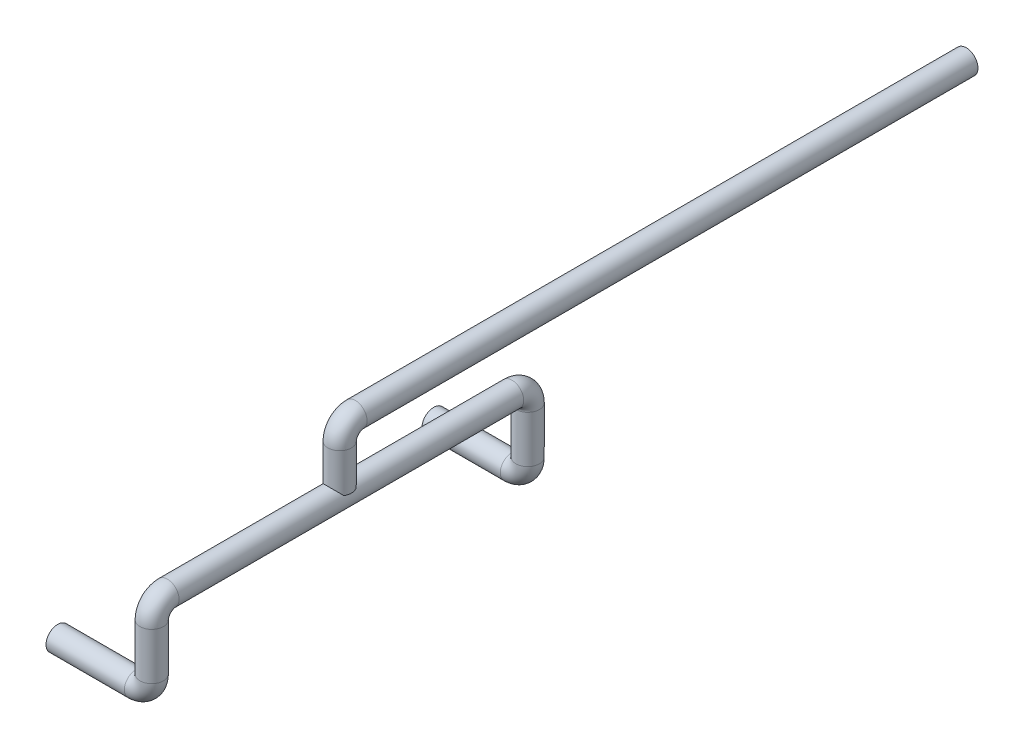
from build123d import *

# Parameters (mm, degrees)
SWEEP1_PROFILE_R     = 7.5
SWEEP2_PROFILE_R     = 7.5
CUT_SWEEP1_PROFILE_R = 6.25
CUT_SWEEP2_PROFILE_R = 6.25


with BuildPart() as part:
    # Sweep1: sweep along a curve in space
    with BuildLine() as sweep1_path:
        Line((-10, -50, 120), (-60, -50, 120))
        ThreePointArc((-10, -50, 120), (-2.928932188, -47.071067812, 120), (0, -40, 120))
        Line((0, -10, 120), (0, -40, 120))
        ThreePointArc((0, -10, 120), (0, -2.928932188, 117.071067812), (0, 0, 110))
        Line((0, 0, 0), (0, 0, 110))
        Line((0, 0, 0), (0, 0, -110))
        ThreePointArc((0, -10, -120), (0, -2.928932188, -117.071067812), (0, 0, -110))
        Line((0, -10, -120), (0, -40, -120))
        ThreePointArc((0, -40, -120), (-2.928932188, -47.071067812, -120), (-10, -50, -120))
        Line((-10, -50, -120), (-60, -50, -120))
    # Sweep1 profile (on start of the path) → Sweep1 (sweep)
    with BuildSketch(Plane(origin=(-60, -50, -120), x_dir=(0, 0, 1), z_dir=(1, 0, 0))):
        Circle(SWEEP1_PROFILE_R)
    sweep(path=sweep1_path.line)

    # Sweep2: sweep along a path in Sketch30
    with BuildLine(Plane(origin=(0, 0, 0), x_dir=(0, 0, -1), z_dir=(1, 0, 0))) as sweep2_path:
        Line((0, 3.788993713), (0, 28.788993713))
        ThreePointArc((0, 28.788993713), (2.928932188, 35.860061525), (10, 38.788993713))
        Line((10, 38.788993713), (400, 38.788993713))
    # Sweep2 profile (on start of the path) → Sweep2 (sweep)
    with BuildSketch(Plane.ZX.offset(3.788993713)):
        Circle(SWEEP2_PROFILE_R)
    sweep(path=sweep2_path.line)

    # Cut-Sweep1: sweep along a curve in space
    with BuildLine() as cut_sweep1_path:
        Line((-10, -50, 120), (-60, -50, 120))
        ThreePointArc((-10, -50, 120), (-2.928932188, -47.071067812, 120), (0, -40, 120))
        Line((0, -10, 120), (0, -40, 120))
        ThreePointArc((0, -10, 120), (0, -2.928932188, 117.071067812), (0, 0, 110))
        Line((0, 0, 0), (0, 0, 110))
        Line((0, 0, 0), (0, 0, -110))
        ThreePointArc((0, -10, -120), (0, -2.928932188, -117.071067812), (0, 0, -110))
        Line((0, -10, -120), (0, -40, -120))
        ThreePointArc((0, -40, -120), (-2.928932188, -47.071067812, -120), (-10, -50, -120))
        Line((-10, -50, -120), (-60, -50, -120))
    # Cut-Sweep1 profile (on start of the path) → Cut-Sweep1 (sweep, cut)
    with BuildSketch(Plane(origin=(-60, -50, -120), x_dir=(0, 0, 1), z_dir=(1, 0, 0))):
        Circle(CUT_SWEEP1_PROFILE_R)
    sweep(path=cut_sweep1_path.line, mode=Mode.SUBTRACT)

    # Cut-Sweep2: sweep along a path in Sketch30<2>
    with BuildLine(Plane(origin=(0, 0, 0), x_dir=(0, 0, -1), z_dir=(1, 0, 0))) as cut_sweep2_path:
        Line((0, 3.788993713), (0, 28.788993713))
        ThreePointArc((0, 28.788993713), (2.928932188, 35.860061525), (10, 38.788993713))
        Line((10, 38.788993713), (400, 38.788993713))
    # Cut-Sweep2 profile (on start of the path) → Cut-Sweep2 (sweep, cut)
    with BuildSketch(Plane.ZX.offset(3.788993713)):
        Circle(CUT_SWEEP2_PROFILE_R)
    sweep(path=cut_sweep2_path.line, mode=Mode.SUBTRACT)


solid = part.part
